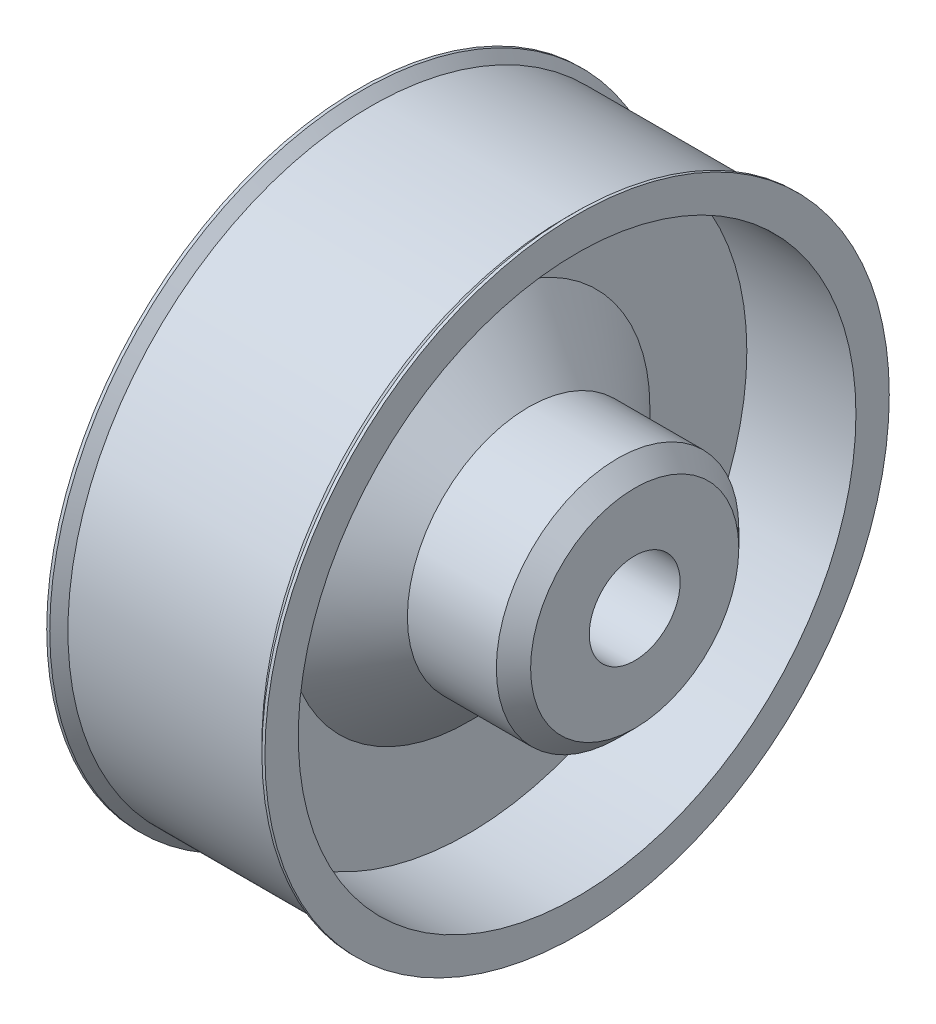
from build123d import *

# Parameters (mm, degrees)
Y_KSEKLIK_EKSTR_ZYON1_DEPTH = 3
DAIRESEL_KAPLAMA1_COUNT     = 9
Y_KSEKLIK_EKSTR_ZYON2_DEPTH = 3
DAIRESEL_KAPLAMA2_COUNT     = 5


with BuildPart() as part:
    # Çizim1 → Döndür1 (revolve)
    with BuildSketch(Plane.XY, mode=Mode.PRIVATE) as d_nd_r1_sk:
        with BuildLine():
            Line((-7.5, 6), (-17.506303134, 3.75))
            Line((-17.506303134, 3.75), (-18, 0))
            Line((-18, 0), (0, 0))
            Line((0, 0), (0, 7.5))
            Line((0, 7.5), (27.5, 7.5))
            Line((27.5, 7.5), (27.5, 17.171572875))
            Line((27.5, 17.171572875), (24.671572875, 20))
            Line((24.671572875, 20), (10, 20))
            Line((10, 20), (0, 30))
            Line((0, 30), (0, 46))
            Line((0, 46), (18, 46))
            Line((18, 46), (18, 51.5))
            Line((18, 51.5), (17.5, 51.5))
            Line((17.5, 51.5), (16, 50))
            Line((16, 50), (-16, 50))
            Line((-16, 50), (-17.5, 51.5))
            Line((-17.5, 51.5), (-18, 51.5))
            Line((-18, 51.5), (-18, 48))
            ThreePointArc((-18, 48), (-17.414213562, 46.585786438), (-16, 46))
            Line((-16, 46), (-10.5, 46))
            ThreePointArc((-10.5, 46), (-8.378679656, 45.121320344), (-7.5, 43))
            Line((-7.5, 43), (-7.5, 33.062305899))
            ThreePointArc((-7.5, 33.062305899), (-8.094648823, 31.269462985), (-9.642857143, 30.187361356))
            ThreePointArc((-9.642857143, 30.187361356), (-15, 23), (-9.642857143, 15.812638644))
            ThreePointArc((-9.642857143, 15.812638644), (-8.094648823, 14.730537015), (-7.5, 12.937694101))
            Line((-7.5, 12.937694101), (-7.5, 6))
        make_face()
    revolve(d_nd_r1_sk.sketch.rotate(Axis((0, 0, 0), (-1, 0, 0)), 90), axis=Axis((0, 0, 0), (-1, 0, 0)))

    # Çizim3 → Yükseklik-Ekstrüzyon1 (add)
    with BuildSketch(Plane.ZY.offset(7.5)):
        Polygon((2.886751346, 37.5), (1.443375673, 40), (-1.443375673, 40), (-2.886751346, 37.5), (-1.443375673, 35), (1.443375673, 35), align=None)
    y_kseklik_ekstr_zyon1 = extrude(amount=Y_KSEKLIK_EKSTR_ZYON1_DEPTH)

    # Dairesel Kaplama1: Yükseklik-Ekstrüzyon1 ×9 about axis
    dairesel_kaplama1_axis = Axis((0, 0, 0), (1, 0, 0))
    for i in range(1, DAIRESEL_KAPLAMA1_COUNT):
        add(y_kseklik_ekstr_zyon1.rotate(dairesel_kaplama1_axis, i * 360 / DAIRESEL_KAPLAMA1_COUNT))

    # Çizim5 → Yükseklik-Ekstrüzyon2 (add)
    with BuildSketch(Plane.ZY.offset(7.5)):
        Polygon((2.886751346, 10), (1.443375673, 12.5), (-1.443375673, 12.5), (-2.886751346, 10), (-1.443375673, 7.5), (1.443375673, 7.5), align=None)
    y_kseklik_ekstr_zyon2 = extrude(amount=Y_KSEKLIK_EKSTR_ZYON2_DEPTH)

    # Dairesel Kaplama2: Yükseklik-Ekstrüzyon2 ×5 about axis
    dairesel_kaplama2_axis = Axis((0, 0, 0), (1, 0, 0))
    for i in range(1, DAIRESEL_KAPLAMA2_COUNT):
        add(y_kseklik_ekstr_zyon2.rotate(dairesel_kaplama2_axis, i * 360 / DAIRESEL_KAPLAMA2_COUNT))


solid = part.part
